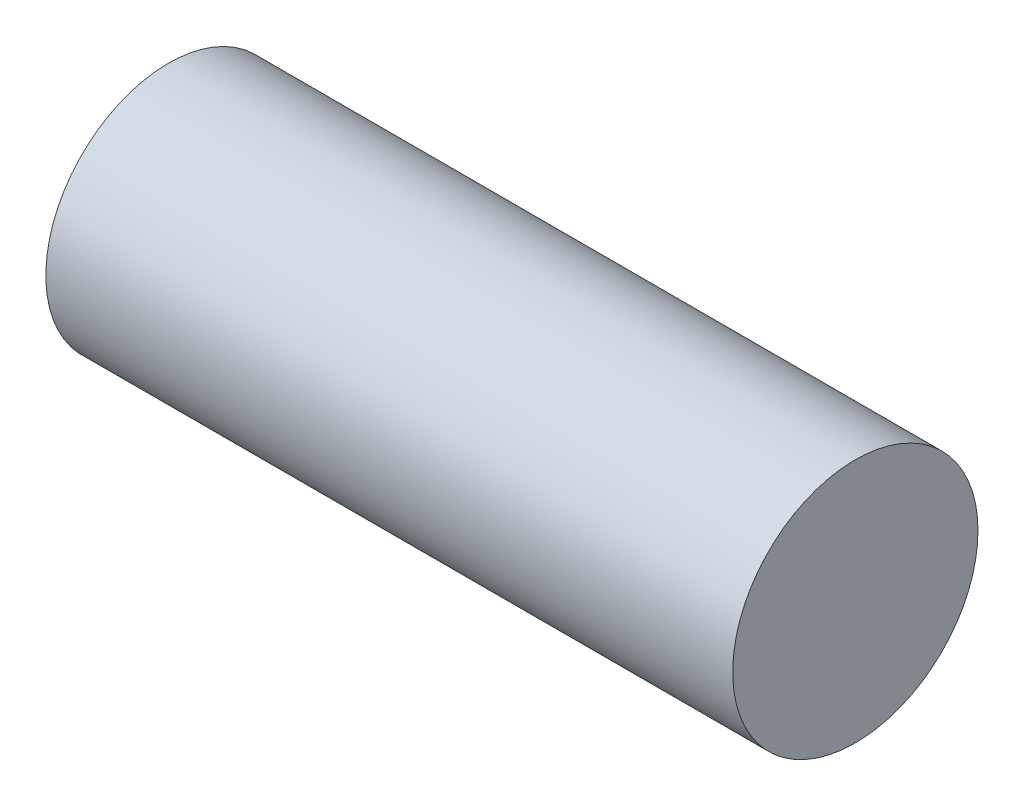
from build123d import *

# Parameters (mm, degrees)
SKETCH1_R           = 3.175
BOSS_EXTRUDE1_DEPTH = 8.89


with BuildPart() as part:
    # Sketch1 → Boss-Extrude1 (new, symmetric)
    with BuildSketch(Plane(origin=(0, 0, 0), x_dir=(0, 0, -1), z_dir=(1, 0, 0))):
        Circle(SKETCH1_R)
    extrude(amount=BOSS_EXTRUDE1_DEPTH, both=True)


solid = part.part
